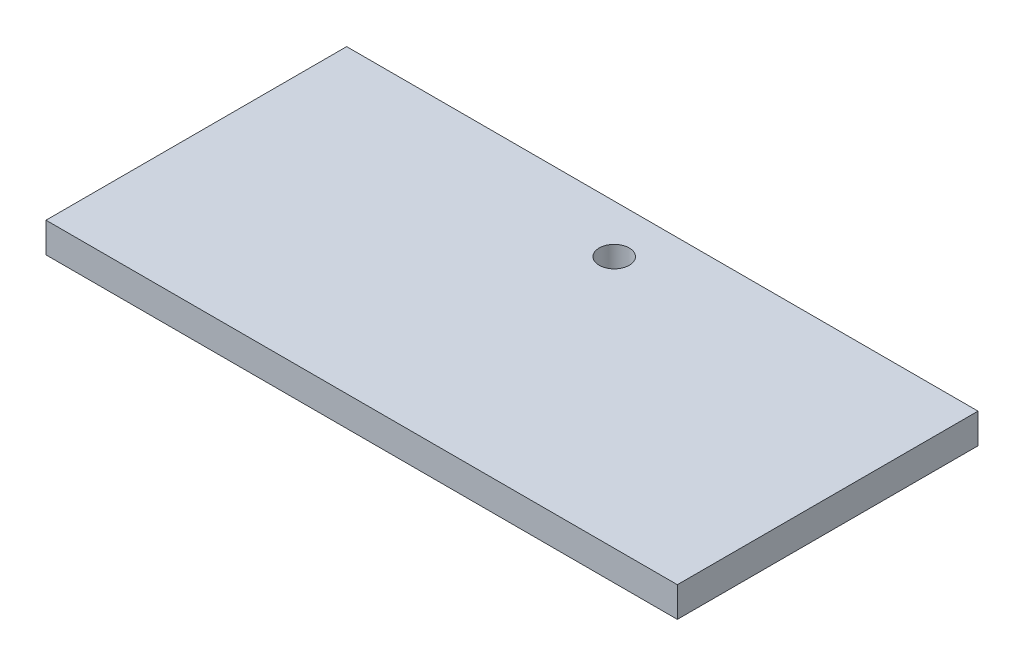
from build123d import *

# Parameters (mm, degrees)
CROQUIS2_W              = 1050
CROQUIS2_H              = 500
CROQUIS2_R              = 25
SALIENTE_EXTRUIR1_DEPTH = 50


with BuildPart() as part:
    # Croquis2 → Saliente-Extruir1 (new body)
    with BuildSketch(Plane(origin=(0, 0, 0), x_dir=(1, 0, 0), z_dir=(0, 1, 0))):
        with Locations((525, 250)):
            Rectangle(CROQUIS2_W, CROQUIS2_H)
        with Locations(Location((525, 420, 0), (0, 0, 270))):
            Circle(CROQUIS2_R, mode=Mode.SUBTRACT)
    extrude(amount=SALIENTE_EXTRUIR1_DEPTH)


solid = part.part
